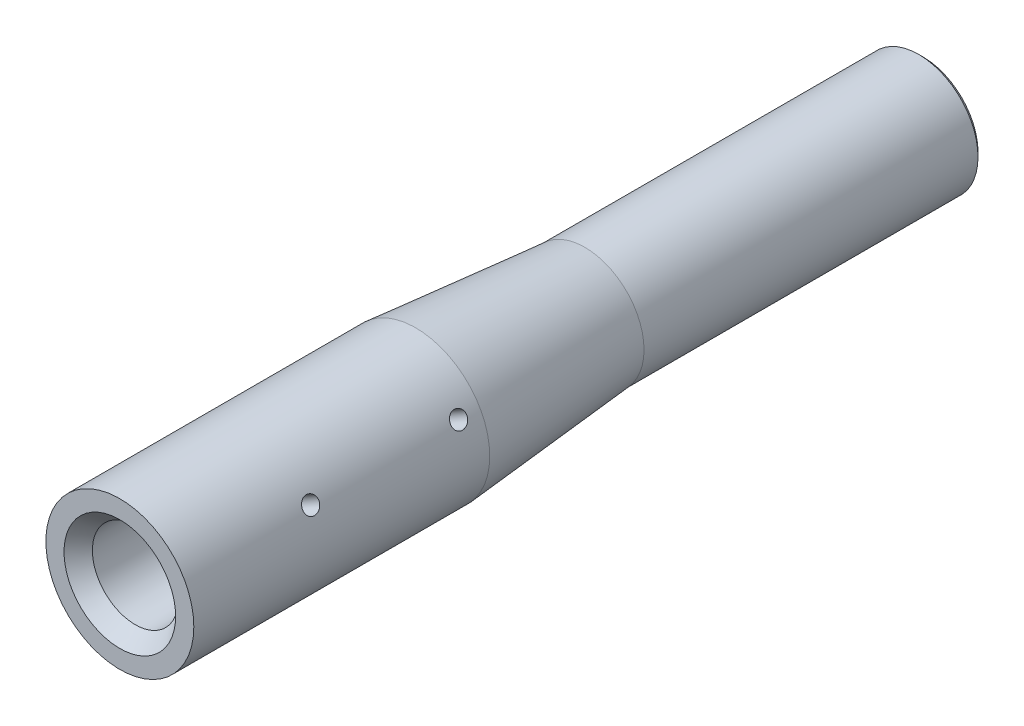
from build123d import *

# Parameters (mm, degrees)
SKETCH_5_R               = 1.925
CUT_EXTRUDE_3_DEPTH      = 6.5
PATTERN_CIRCULAR_1_COUNT = 3
CUT_EXTRUDE_4_REACH      = 100.655
SKETCH_6_R               = 10.15
CHAMFER_1_SIZE           = 1
CHAMFER_2_SIZE           = 0.5
CHAMFER_3_SIZE           = 3
CHAMFER_3_SIZE2          = 3.645101124


with BuildPart() as part:
    # 스케치2 → 회전1 (revolve)
    with BuildSketch(Plane(origin=(0, 0, 0), x_dir=(0, 0, -1), z_dir=(1, 0, 0)), mode=Mode.PRIVATE) as revolve_1_sk:
        Polygon((0.919706719, -10.18531024), (0, -10.2), (0, -17.5), (70, -17.5), (110, -14), (190, -14), (190, 0), (95.5, 0), (95.5, -7.175), (79.5, -7.175), (72, -9.05), align=None)
    revolve(revolve_1_sk.sketch.rotate(Axis((0, 0, 0), (0, 0, -1)), 270), axis=Axis((0, 0, 0), (0, 0, -1)))

    # 스케치5 → 컷-돌출3 (cut)
    with BuildSketch(Plane(origin=(0, -17.5, 0), x_dir=(-1, 0, 0), z_dir=(0, -1, 0))):
        with Locations(Location((0, 30, 0), (0, 0, 90))):
            Circle(SKETCH_5_R)
        with Locations(Location((0, 65, 0), (0, 0, 90))):
            Circle(SKETCH_5_R)
    cut_extrude_3 = extrude(amount=-CUT_EXTRUDE_3_DEPTH, mode=Mode.SUBTRACT)

    # 원형 패턴1: 컷-돌출3 ×3 about axis
    pattern_circular_1_axis = Axis((0, 0, 0), (0, 0, 1))
    for i in range(1, PATTERN_CIRCULAR_1_COUNT):
        add(cut_extrude_3.rotate(pattern_circular_1_axis, i * 360 / PATTERN_CIRCULAR_1_COUNT), mode=Mode.SUBTRACT)

    # 스케치6 → 컷-돌출4 (cut, up to next)
    with BuildSketch(Plane.XY.offset(-95.5), mode=Mode.PRIVATE) as cut_extrude_4_sk1:
        Circle(SKETCH_6_R)
    cut_extrude_4_tool1 = extrude(cut_extrude_4_sk1.sketch, amount=-CUT_EXTRUDE_4_REACH, mode=Mode.PRIVATE) & part.part
    add(cut_extrude_4_tool1.solids().sort_by_distance((0, 0, -95.5))[0], mode=Mode.SUBTRACT)

    # 모따기1
    chamfer_1_edges = [part.edges().sort_by_distance(p)[0] for p in [
        (-14, 0, -190),
    ]]
    chamfer(chamfer_1_edges, length=CHAMFER_1_SIZE)

    # 모따기2
    chamfer_2_edges = [part.edges().sort_by_distance(p)[0] for p in [
        (-10.15, 0, -190),
    ]]
    chamfer(chamfer_2_edges, length=CHAMFER_2_SIZE)

    # 모따기3
    chamfer_3_edges = [part.edges().sort_by_distance(p)[0] for p in [
        (-10.2, 0, 0),
    ]]
    chamfer_3_side = [part.faces().sort_by_distance(p)[0] for p in [
        (-10.694974747, 0, 0),
    ]]
    chamfer(chamfer_3_edges, length=CHAMFER_3_SIZE, length2=CHAMFER_3_SIZE2, reference=chamfer_3_side[0])


solid = part.part
